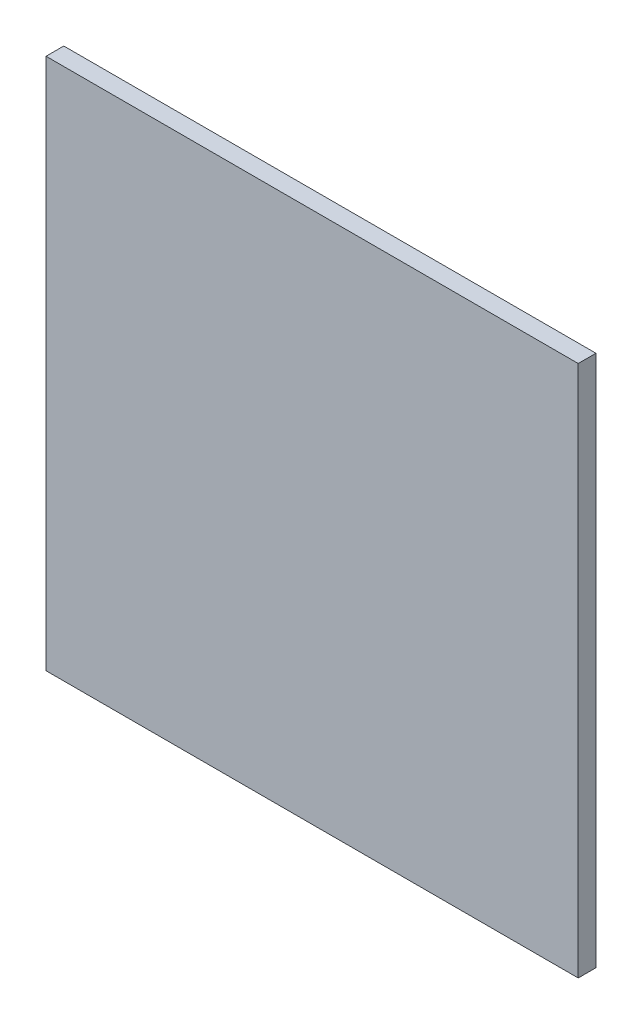
from build123d import *

# Parameters (mm, degrees)
SKETCH_1_W      = 60
SKETCH_1_H      = 60
EXTRUDE_1_DEPTH = 2


with BuildPart() as part:
    # Sketch 1 → Бобышка-Вытянуть1 (new body)
    with BuildSketch(Plane.XY):
        Rectangle(SKETCH_1_W, SKETCH_1_H)
    extrude(amount=EXTRUDE_1_DEPTH)


solid = part.part
